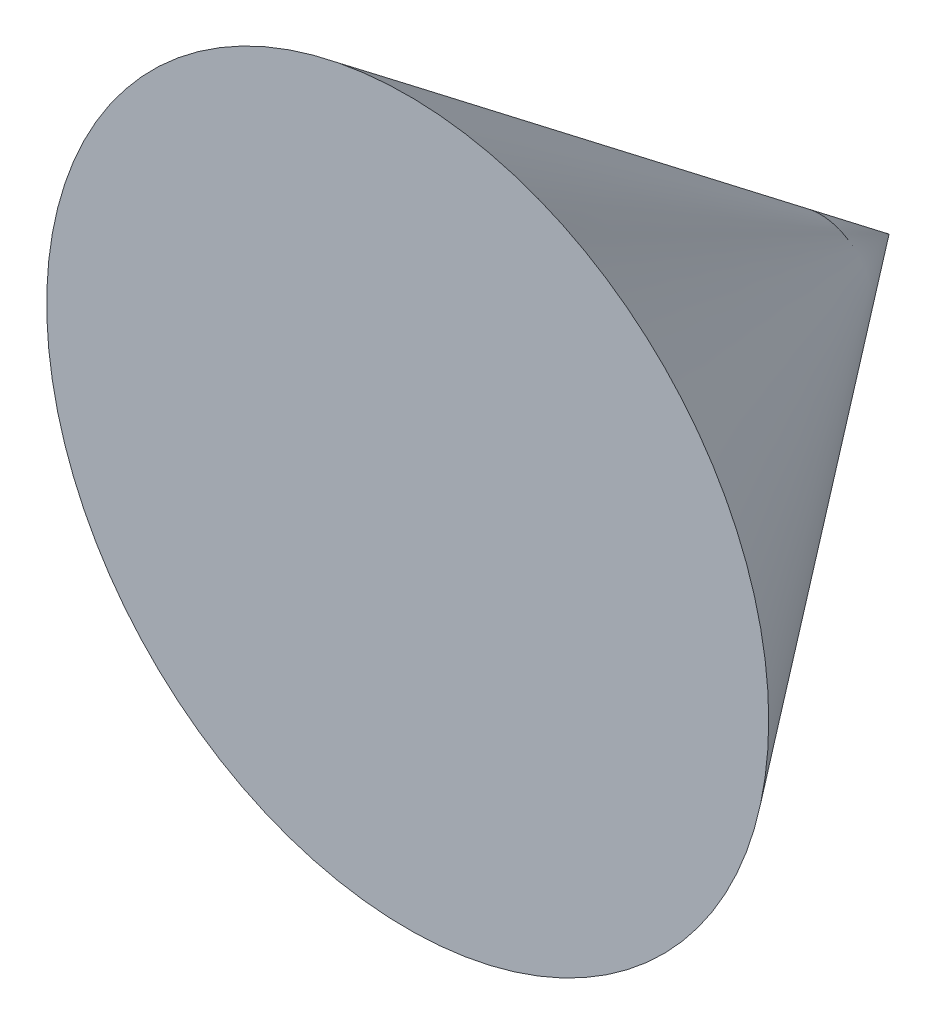
from build123d import *


with BuildPart() as part:
    # 草图1 → 旋转1 (revolve)
    with BuildSketch(Plane(origin=(0, 0, 0), x_dir=(1, 0, 0), z_dir=(0, 1, 0))):
        Polygon((0, 0), (150, 0), (0, 200), align=None)
    revolve(axis=Axis((0, 0, 0), (0, 0, -1)))


solid = part.part
